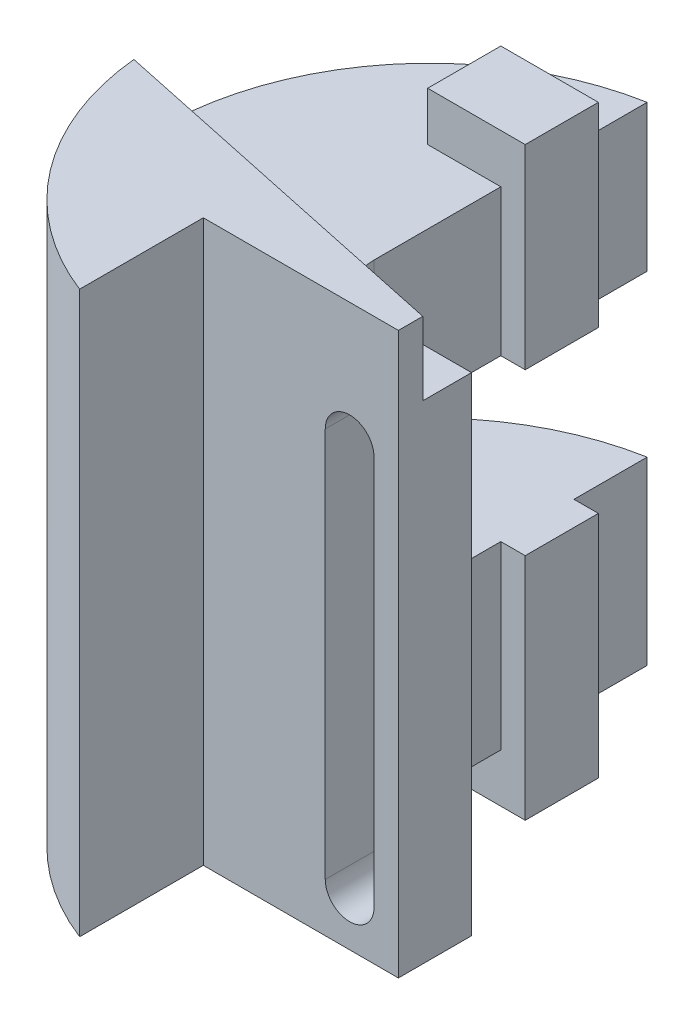
from build123d import *

# Parameters (mm, degrees)
BOSS_EXTRUDE1_DEPTH = 100
BOSS_EXTRUDE2_DEPTH = 15
CUT_EXTRUDE1_DEPTH  = 15
SKETCH6_W           = 20
SKETCH6_H           = 15
BOSS_EXTRUDE3_DEPTH = 10
SKETCH5_W           = 20
SKETCH5_H           = 15
BOSS_EXTRUDE4_DEPTH = 10
SKETCH7_W           = 40
SKETCH7_H           = 33
CUT_EXTRUDE2_DEPTH  = 70


with BuildPart() as part:
    # Sketch1 → Boss-Extrude1 (new body)
    with BuildSketch(Plane(origin=(0, 0, 0), x_dir=(1, 0, 0), z_dir=(0, 1, 0))):
        with BuildLine():
            Line((0, 0), (0, -15))
            Line((0, -15), (5, -15))
            Line((5, -15), (5, -30))
            Line((5, -30), (0, -30))
            Line((0, -30), (0, -56))
            ThreePointArc((0, -56), (2.928932188, -63.071067812), (10, -66))
            Line((10, -66), (30, -66))
            Line((30, -66), (30, -81))
            Line((30, -81), (-10, -81))
            Line((-10, -81), (-10, -106.362796982))
            ThreePointArc((-10, -106.362796982), (-45.256322222, -49.396586192), (0, 0))
        make_face()
    extrude(amount=BOSS_EXTRUDE1_DEPTH)

    # Sketch2 → Boss-Extrude2 (add)
    with BuildSketch(Plane(origin=(0, 100, 0), x_dir=(1, 0, 0), z_dir=(0, 1, 0))):
        with BuildLine():
            Line((30, -81), (30, -76))
            Line((30, -76), (-45.235044142, -60.0082977))
            ThreePointArc((-45.235044142, -60.0082977), (-34.184418834, -88.177185713), (-10, -106.362796982))
            Line((-10, -106.362796982), (-10, -81))
            Line((-10, -81), (30, -81))
        make_face()
    extrude(amount=BOSS_EXTRUDE2_DEPTH)

    # Sketch4 → Cut-Extrude1 (cut)
    with BuildSketch(Plane(origin=(0, 0, 66), x_dir=(-1, 0, 0), z_dir=(0, 0, -1))):
        with BuildLine():
            Line((-15, 90), (-15, 10))
            ThreePointArc((-15, 10), (-20, 5), (-25, 10))
            Line((-25, 10), (-25, 90))
            ThreePointArc((-25, 90), (-20, 95), (-15, 90))
        make_face()
    extrude(amount=-CUT_EXTRUDE1_DEPTH, mode=Mode.SUBTRACT)

    # Sketch6 → Boss-Extrude3 (add)
    with BuildSketch(Plane(origin=(0, 0, 0), x_dir=(-1, 0, 0), z_dir=(0, -1, 0))):
        with Locations((5, -22.5)):
            Rectangle(SKETCH6_W, SKETCH6_H)
    extrude(amount=BOSS_EXTRUDE3_DEPTH)

    # Sketch5 → Boss-Extrude4 (add)
    with BuildSketch(Plane(origin=(0, 100, 0), x_dir=(1, 0, 0), z_dir=(0, 1, 0))):
        with Locations((-5, -22.5)):
            Rectangle(SKETCH5_W, SKETCH5_H)
    extrude(amount=BOSS_EXTRUDE4_DEPTH)

    # Sketch7 → Cut-Extrude2 (cut)
    with BuildSketch(Plane(origin=(5, 0, 0), x_dir=(0, 0, -1), z_dir=(1, 0, 0))):
        with Locations((-20, 53.5)):
            Rectangle(SKETCH7_W, SKETCH7_H)
    extrude(amount=-CUT_EXTRUDE2_DEPTH, mode=Mode.SUBTRACT)


solid = part.part
